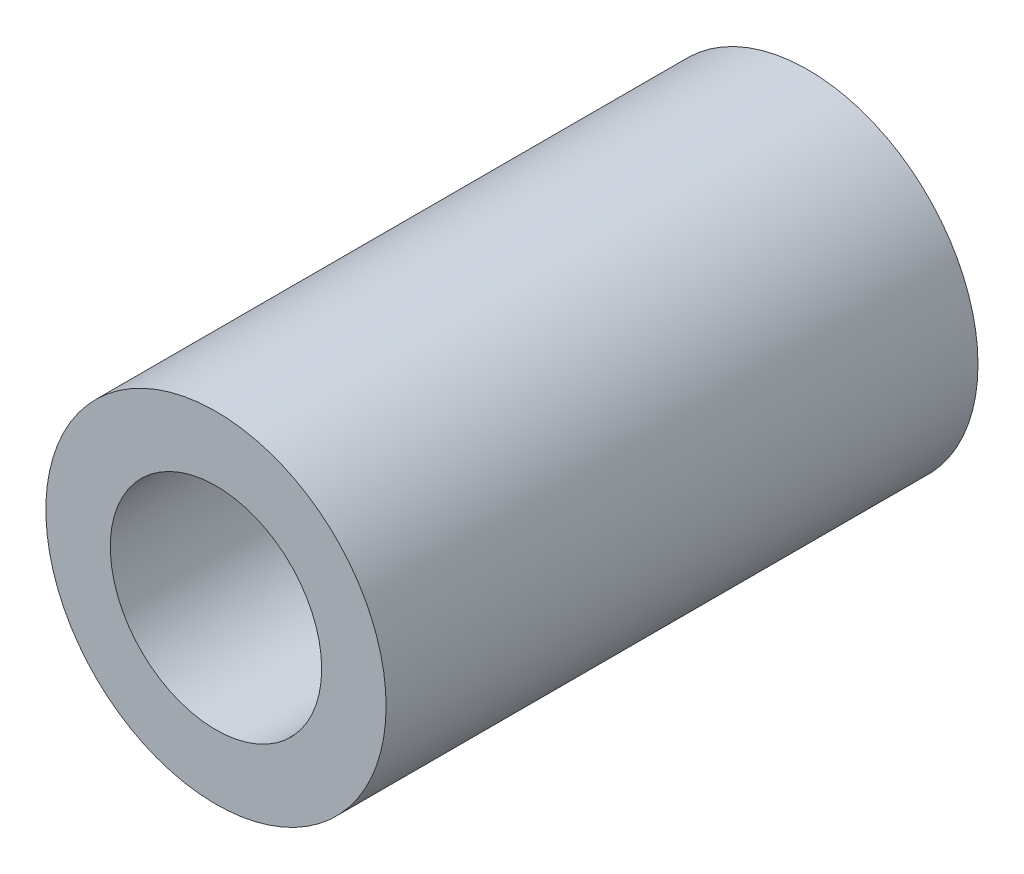
from build123d import *

# Parameters (mm, degrees)
SKETCH5_R           = 6.3881
SKETCH5_R_2         = 3.96875
BOSS_EXTRUDE1_DEPTH = 11.1125


with BuildPart() as part:
    # Sketch5 → Boss-Extrude1 (new, symmetric)
    with BuildSketch(Plane.XY):
        Circle(SKETCH5_R)
        Circle(SKETCH5_R_2, mode=Mode.SUBTRACT)
    extrude(amount=BOSS_EXTRUDE1_DEPTH, both=True)


solid = part.part
